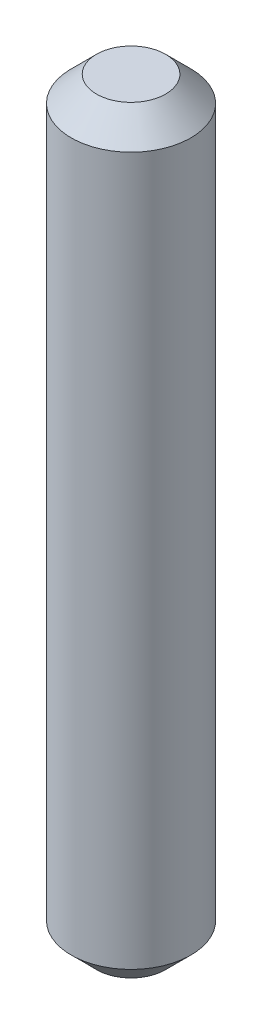
from build123d import *


with BuildPart() as part:
    # Sketch1 → Revolve1 (revolve)
    with BuildSketch(Plane.XY, mode=Mode.PRIVATE) as revolve1_sk:
        Polygon((0, 0), (0, 11.43), (0.5207, 11.43), (0.9017, 11.049), (0.9017, 0.381), (0.5207, 0), align=None)
    revolve(revolve1_sk.sketch.rotate(Axis((0, 0, 0), (0, 1, 0)), 90), axis=Axis((0, 0, 0), (0, 1, 0)))


solid = part.part
